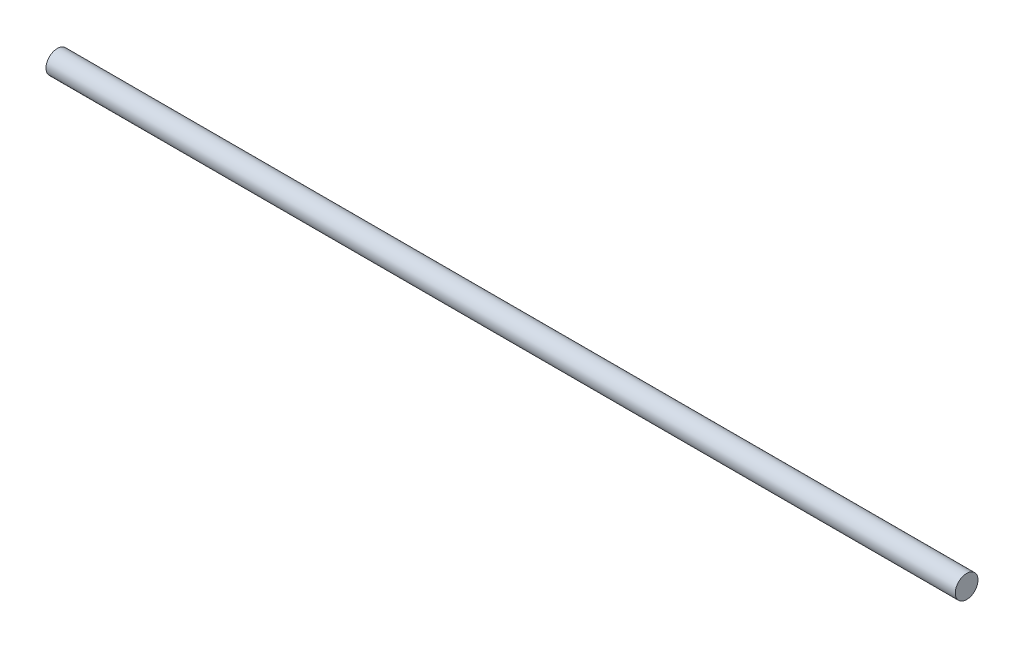
from build123d import *

# Parameters (mm, degrees)
SKETCH_1_R      = 1.25
EXTRUDE_1_DEPTH = 50


with BuildPart() as part:
    # 스케치1 → 보스-돌출1 (new, symmetric)
    with BuildSketch(Plane(origin=(0, 0, 0), x_dir=(0, 0, -1), z_dir=(1, 0, 0))):
        Circle(SKETCH_1_R)
    extrude(amount=EXTRUDE_1_DEPTH, both=True)


solid = part.part
